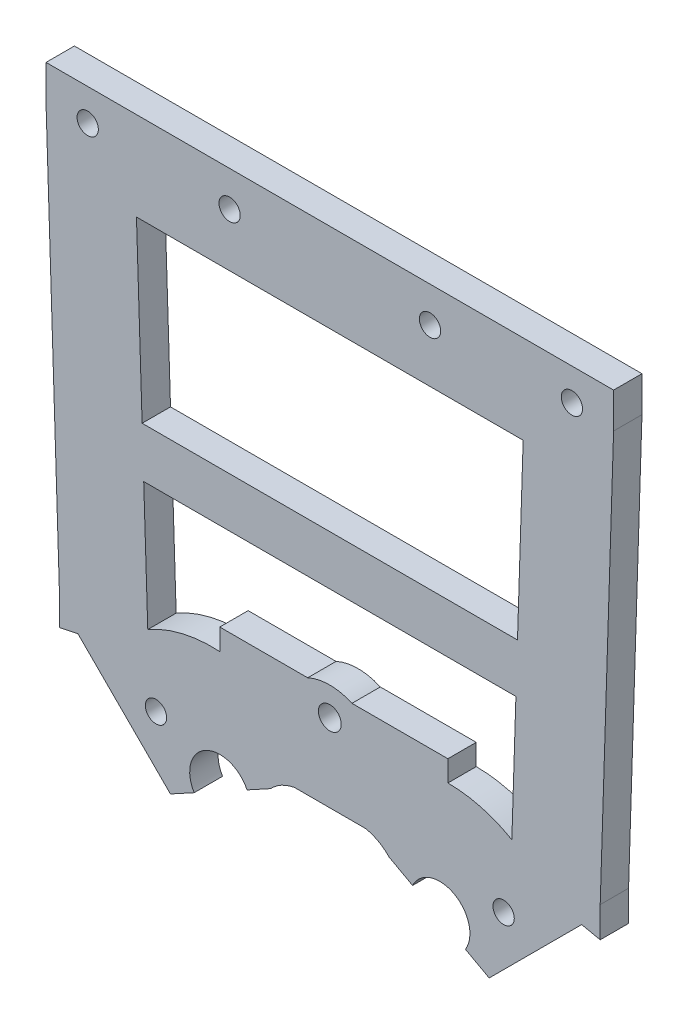
from build123d import *

# Parameters (mm, degrees)
SKETCH1_R           = 1.5
SKETCH1_R_2         = 1.610311209
BOSS_EXTRUDE1_DEPTH = 4
CUT_EXTRUDE1_START  = -4
CUT_EXTRUDE1_DEPTH  = 4


with BuildPart() as part:
    # Sketch1 → Boss-Extrude1 (new body)
    with BuildSketch(Plane.XY):
        with BuildLine():
            Line((-40, 64.661867252), (-38.110698604, 5.904474432))
            Line((-38.110698604, 5.904474432), (-38.110698604, 1.610311209))
            Line((-38.110698604, 1.610311209), (-35.5, 2.161867252))
            Line((-35.5, 2.161867252), (-22.464466094, -10.873666654))
            Line((-22.464466094, -10.873666654), (-16.914557514, -7.843437092))
            ThreePointArc((-16.914557514, -7.843437092), (-16.338632472, -5.277165438), (-13.868441411, -6.180268964))
            Line((-13.868441411, -6.180268964), (-8.352527173, -3.168600187))
            ThreePointArc((-8.352527173, -3.168600187), (-6.823233186, -1.984189553), (-5, -1.338132748))
            Line((-5, -1.338132748), (5, -1.338132748))
            ThreePointArc((5, -1.338132748), (6.823233186, -1.984189553), (8.352527173, -3.168600187))
            Line((8.352527173, -3.168600187), (13.868441411, -6.180268964))
            ThreePointArc((13.868441411, -6.180268964), (16.338632472, -5.277165438), (16.914557514, -7.843437092))
            Line((16.914557514, -7.843437092), (22.464466094, -10.873666654))
            Line((22.464466094, -10.873666654), (35.5, 2.161867252))
            Line((35.5, 2.161867252), (38.110698604, 1.610311209))
            Line((38.110698604, 1.610311209), (38.110698604, 5.904474432))
            Line((38.110698604, 5.904474432), (40, 64.661867252))
            Line((40, 64.661867252), (40, 69.661867252))
            Line((40, 69.661867252), (-40, 69.661867252))
            Line((-40, 69.661867252), (-40, 64.661867252))
        make_face()
        with BuildLine():
            Line((16.639882489, 12.98256249), (3.11899286, 12.98256249))
            ThreePointArc((3.11899286, 12.98256249), (0, 13.661867252), (-3.11899286, 12.98256249))
            Line((-3.11899286, 12.98256249), (-15.511590599, 12.98256249))
            Line((-15.511590599, 12.98256249), (-15.511590599, 9.98256249))
            ThreePointArc((-15.511590599, 9.98256249), (-20.760848223, 9.540954041), (-25.658820737, 7.60198811))
            Line((-25.658820737, 7.60198811), (-26.230521812, 25.381927681))
            Line((-26.230521812, 25.381927681), (26.230521812, 25.381927681))
            Line((26.230521812, 25.381927681), (25.658820737, 7.60198811))
            ThreePointArc((25.658820737, 7.60198811), (21.308334072, 9.403441757), (16.639882489, 10.017875862))
            Line((16.639882489, 10.017875862), (16.639882489, 12.98256249))
        make_face(mode=Mode.SUBTRACT)
        with Locations((-34.124535685, 65.161867252)):
            Circle(SKETCH1_R, mode=Mode.SUBTRACT)
        with Locations((-14.124535685, 64.661867252)):
            Circle(SKETCH1_R, mode=Mode.SUBTRACT)
        Polygon((-26.45560174, 32.381927681), (-27.252382744, 57.161867252), (27.252382744, 57.161867252), (26.45560174, 32.381927681), align=None, mode=Mode.SUBTRACT)
        with Locations((14.124535685, 64.661867252)):
            Circle(SKETCH1_R, mode=Mode.SUBTRACT)
        with Locations((34.124535685, 65.161867252)):
            Circle(SKETCH1_R, mode=Mode.SUBTRACT)
        with Locations((-24.5, -1.838132748)):
            Circle(SKETCH1_R, mode=Mode.SUBTRACT)
        with Locations((0, 9.661867252)):
            Circle(SKETCH1_R_2, mode=Mode.SUBTRACT)
        with Locations((24.5, -1.838132748)):
            Circle(SKETCH1_R, mode=Mode.SUBTRACT)
    extrude(amount=BOSS_EXTRUDE1_DEPTH)

    # Sketch2 → Cut-Extrude1 (cut)
    with BuildSketch(Plane.XY.offset(4).offset(CUT_EXTRUDE1_START)):
        with BuildLine():
            Line((-19.116408786, -9.045639745), (-16.914557514, -7.843437092))
            ThreePointArc((-16.914557514, -7.843437092), (-16.338632472, -5.277165438), (-13.868441411, -6.180268964))
            Line((-13.868441411, -6.180268964), (-11.666590138, -4.978066311))
            ThreePointArc((-11.666590138, -4.978066311), (-17.536678859, -3.082926424), (-19.116408786, -9.045639745))
        make_face()
        with BuildLine():
            Line((16.914557514, -7.843437092), (19.116408786, -9.045639745))
            ThreePointArc((19.116408786, -9.045639745), (17.536678859, -3.082926424), (11.666590138, -4.978066311))
            Line((11.666590138, -4.978066311), (13.868441411, -6.180268964))
            ThreePointArc((13.868441411, -6.180268964), (16.338632472, -5.277165438), (16.914557514, -7.843437092))
        make_face()
    extrude(amount=CUT_EXTRUDE1_DEPTH, mode=Mode.SUBTRACT)


solid = part.part
